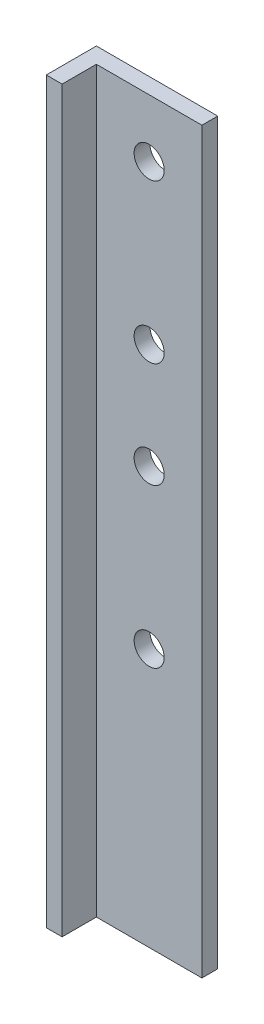
from build123d import *

# Parameters (mm, degrees)
SKETCH1_W           = 23
SKETCH1_H           = 140
BOSS_EXTRUDE1_DEPTH = 3
SKETCH4_W           = 3
SKETCH4_H           = 140
BOSS_EXTRUDE3_DEPTH = 6.5
SKETCH3_R           = 2.85
CUT_EXTRUDE5_DEPTH  = 8.5


with BuildPart() as part:
    # Sketch1 → Boss-Extrude1 (new body)
    with BuildSketch(Plane.XY):
        Rectangle(SKETCH1_W, SKETCH1_H)
    extrude(amount=-BOSS_EXTRUDE1_DEPTH)

    # Sketch4 → Boss-Extrude3 (add)
    with BuildSketch(Plane.XY):
        with Locations((-10, 0)):
            Rectangle(SKETCH4_W, SKETCH4_H)
    extrude(amount=BOSS_EXTRUDE3_DEPTH)

    # Sketch3 → Cut-Extrude5 (cut)
    with BuildSketch(Plane.XY):
        with Locations((1.5, 59)):
            Circle(SKETCH3_R)
        with Locations((1.5, 29)):
            Circle(SKETCH3_R)
        with Locations((1.5, 9)):
            Circle(SKETCH3_R)
        with Locations((1.5, -21)):
            Circle(SKETCH3_R)
    extrude(amount=-CUT_EXTRUDE5_DEPTH, mode=Mode.SUBTRACT)


solid = part.part
